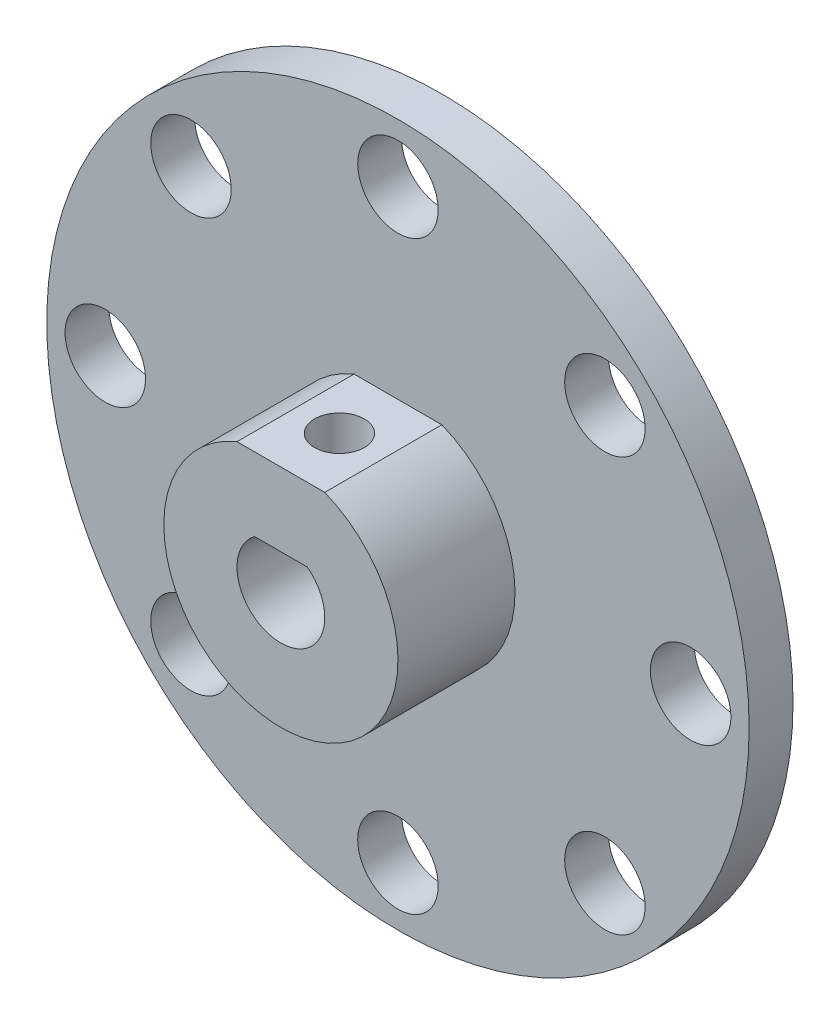
from build123d import *

# Parameters (mm, degrees)
CORTAR_EXTRUIR1_DEPTH            = 10
TALADRO_DE_MARGEN_PARA_M51_D     = 5.5
CORTAR_EXTRUIR2_DEPTH            = 8
TALADRO_DE_MARGEN_PARA_M31_D     = 3.4
TALADRO_DE_MARGEN_PARA_M31_DEPTH = 5.016198487


with BuildPart() as part:
    # Croquis1 → Revolución1 (revolve)
    with BuildSketch(Plane(origin=(0, 0, 0), x_dir=(0, 0, -1), z_dir=(1, 0, 0)), mode=Mode.PRIVATE) as revoluci_n1_sk:
        Polygon((-6.5, 0), (6.5, 0), (6.5, 9), (4.5, 9), (4.5, 24), (1.5, 24), (1.5, 8), (-6.5, 8), align=None)
    revolve(revoluci_n1_sk.sketch.rotate(Axis((0, 0, 25.623234534), (0, 0, -1)), 90), axis=Axis((0, 0, 25.623234534), (0, 0, -1)))

    # Croquis2 → Cortar-Extruir1 (cut)
    with BuildSketch(Plane.XY.offset(6.5)):
        with BuildLine():
            Line((-1.8, 2.4), (1.8, 2.4))
            ThreePointArc((1.8, 2.4), (0, -3), (-1.8, 2.4))
        make_face()
    extrude(amount=-CORTAR_EXTRUIR1_DEPTH, mode=Mode.SUBTRACT)

    # Taladro de margen para M51 (through all)
    with Locations(Plane(origin=(0, 20, -4.5), x_dir=(-1, 0, 0), z_dir=(0, 0, -1))):
        with Locations((0, 0), (14.142135624, -5.857864376), (20, -20), (14.142135624, -34.142135624), (0, -40), (-14.142135624, -34.142135624), (-20, -20), (-14.142135624, -5.857864376)):
            Hole(TALADRO_DE_MARGEN_PARA_M51_D / 2)

    # Croquis10 → Cortar-Extruir2 (cut)
    with BuildSketch(Plane.XY.offset(6.5)):
        with BuildLine():
            Line((-3, 7.416198487), (3, 7.416198487))
            ThreePointArc((3, 7.416198487), (0, 8), (-3, 7.416198487))
        make_face()
    extrude(amount=-CORTAR_EXTRUIR2_DEPTH, mode=Mode.SUBTRACT)

    # Taladro de margen para M31
    with Locations(Plane(origin=(0, 7.416198487, 2.5), x_dir=(0, 0, 1), z_dir=(0, 1, 0))):
        with Locations((0, 0)):
            Hole(TALADRO_DE_MARGEN_PARA_M31_D / 2, depth=TALADRO_DE_MARGEN_PARA_M31_DEPTH)


solid = part.part
